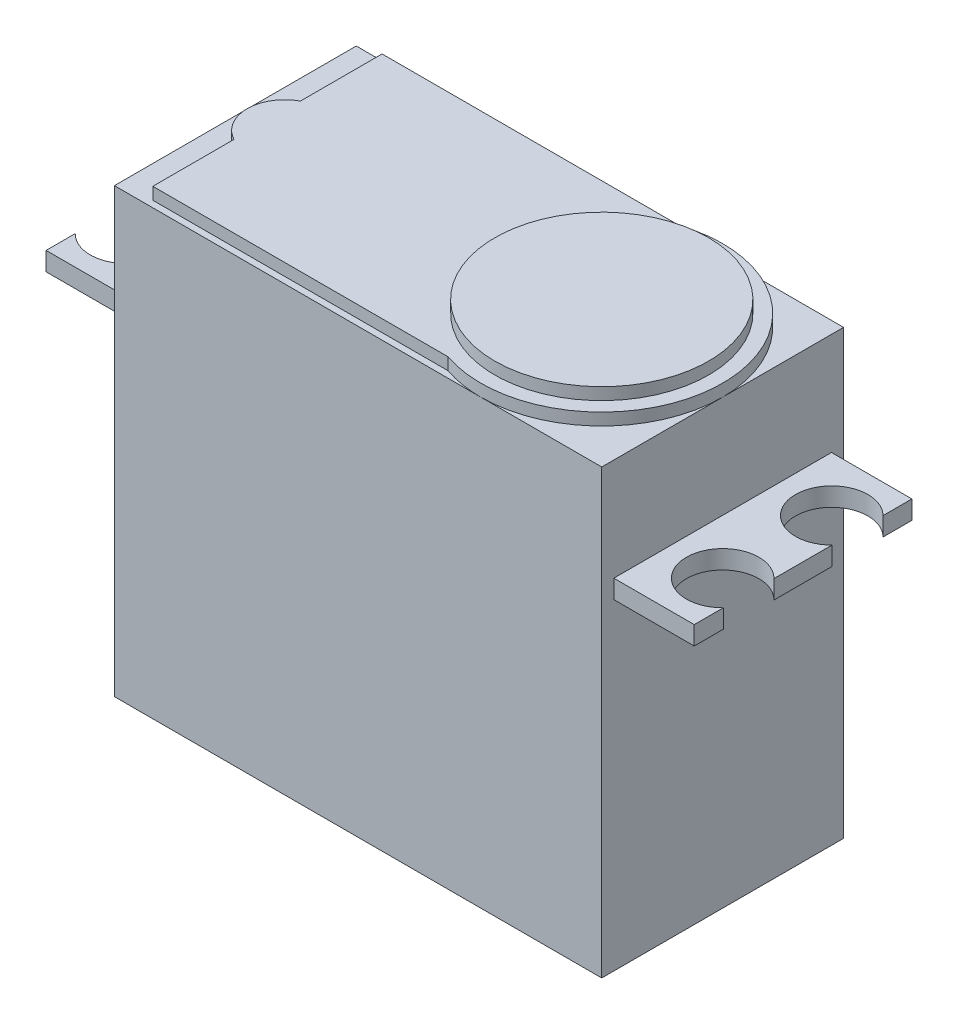
from build123d import *

# Parameters (mm, degrees)
SKETCH1_W                = 40.3
SKETCH1_H                = 20
BOSS_EXTRUDE1_DEPTH      = 36.6
SKETCH5_R                = 10
SKETCH5_R_2              = 3.103657719
SKETCH5_W                = 24.542402665
SKETCH5_H                = 18.960707226
BOSS_EXTRUDE4_DEPTH      = 1
SKETCH7_R                = 8.840936892
BOSS_EXTRUDE5_DEPTH      = 1
BOSS_EXTRUDE7_DEPTH      = 6.65
BOSS_EXTRUDE7_DEPTH_BACK = 46.95
SKETCH8_W                = 18
SKETCH8_H                = 1.536098692
SKETCH10_R               = 3
CUT_EXTRUDE2_DEPTH       = 45.336639532
SKETCH12_R               = 3
CUT_EXTRUDE3_DEPTH       = 45.336639532
SKETCH16_W               = 7
SKETCH16_H               = 3
BOSS_EXTRUDE8_DEPTH      = 5


with BuildPart() as part:
    # Sketch1 → Boss-Extrude1 (new body)
    with BuildSketch(Plane(origin=(0, 0, 0), x_dir=(1, 0, 0), z_dir=(0, 1, 0))):
        with Locations((-5.865266654, 0.347845658)):
            Rectangle(SKETCH1_W, SKETCH1_H)
    extrude(amount=BOSS_EXTRUDE1_DEPTH)

    # Sketch5 → Boss-Extrude4 (add)
    with BuildSketch(Plane(origin=(0, 36.6, 0), x_dir=(1, 0, 0), z_dir=(0, 1, 0))):
        with Locations((4.284733346, 0.347845658)):
            Circle(SKETCH5_R)
        with Locations((-21.934362756, 0.347845658)):
            Circle(SKETCH5_R_2)
        with Locations((-11.108966986, 0.367492045)):
            Rectangle(SKETCH5_W, SKETCH5_H)
    extrude(amount=BOSS_EXTRUDE4_DEPTH)

    # Sketch7 → Boss-Extrude5 (add)
    with BuildSketch(Plane(origin=(0, 37.6, 0), x_dir=(1, 0, 0), z_dir=(0, 1, 0))):
        with Locations(Location((4.284733346, 0.347845658, 0), (0, 0, 90))):
            Circle(SKETCH7_R)
    extrude(amount=BOSS_EXTRUDE5_DEPTH)

    # Sketch8 → Boss-Extrude7 (add, two sides: drawn at the far end of the back side and taken through both)
    with BuildSketch(Plane.ZY.offset(26.015266654).offset(-BOSS_EXTRUDE7_DEPTH_BACK)):
        with Locations((-0.347845658, 27.368049346)):
            Rectangle(SKETCH8_W, SKETCH8_H)
    extrude(amount=BOSS_EXTRUDE7_DEPTH + BOSS_EXTRUDE7_DEPTH_BACK)

    # Sketch10 → Cut-Extrude2 (cut, through all)
    with BuildSketch(Plane(origin=(0, 28.136098692, 0), x_dir=(1, 0, 0), z_dir=(0, 1, 0))):
        with Locations((18.80418216, 4.847845658)):
            Circle(SKETCH10_R)
        with Locations((18.784733346, -4.152133328)):
            Circle(SKETCH10_R)
    extrude(amount=-CUT_EXTRUDE2_DEPTH, mode=Mode.SUBTRACT)

    # Sketch12 → Cut-Extrude3 (cut, through all)
    with BuildSketch(Plane(origin=(0, 28.136098692, 0), x_dir=(1, 0, 0), z_dir=(0, 1, 0))):
        with Locations((-30.515266654, 4.847845658)):
            Circle(SKETCH12_R)
        with Locations((-30.515266654, -4.152154342)):
            Circle(SKETCH12_R)
    extrude(amount=-CUT_EXTRUDE3_DEPTH, mode=Mode.SUBTRACT)

    # Sketch16 → Boss-Extrude8 (add)
    with BuildSketch(Plane.ZY.offset(26.015266654)):
        with Locations((-0.347845658, 5.5)):
            Rectangle(SKETCH16_W, SKETCH16_H)
    extrude(amount=BOSS_EXTRUDE8_DEPTH)


solid = part.part
